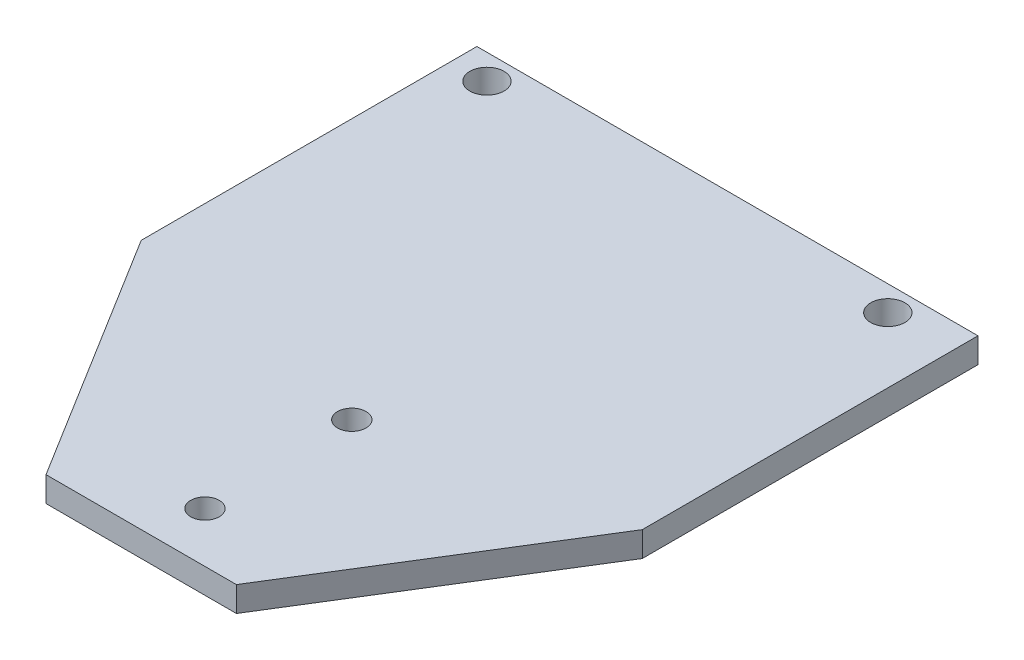
from build123d import *

# Parameters (mm, degrees)
SKETCH1_R               = 3.415098232
SKETCH1_R_2             = 3.415
BOSS_EXTRUDE1_DEPTH     = 5
CUT_EXTRUDE1_DEPTH      = 121.474063599
CUT_EXTRUDE1_DEPTH_BACK = 121.474063599
SKETCH2_R               = 2.85


with BuildPart() as part:
    # Sketch1 → Boss-Extrude1 (new body)
    with BuildSketch(Plane(origin=(0, 0, 0), x_dir=(1, 0, 0), z_dir=(0, 1, 0))):
        Polygon((0, 0), (0, 67), (100, 67), (100, 0), (69, -50), (31, -50), align=None)
        with Locations(Location((87, 62, 0), (0, 0, 270))):
            Circle(SKETCH1_R, mode=Mode.SUBTRACT)
        with Locations(Location((7, 62, 0), (0, 0, 270))):
            Circle(SKETCH1_R_2, mode=Mode.SUBTRACT)
    extrude(amount=BOSS_EXTRUDE1_DEPTH)

    # Sketch2 → Cut-Extrude1 (cut, two sides: drawn at the far end of the back side and taken through both)
    with BuildSketch(Plane(origin=(0, 5, 0), x_dir=(1, 0, 0), z_dir=(0, 1, 0)).offset(-CUT_EXTRUDE1_DEPTH_BACK)):
        with Locations(Location((52.720540919, -40, 0), (0, 0, 270))):
            Circle(SKETCH2_R)
        with Locations(Location((52.028877973, -10, 0), (0, 0, 270))):
            Circle(SKETCH2_R)
    extrude(amount=CUT_EXTRUDE1_DEPTH + CUT_EXTRUDE1_DEPTH_BACK, mode=Mode.SUBTRACT)


solid = part.part
